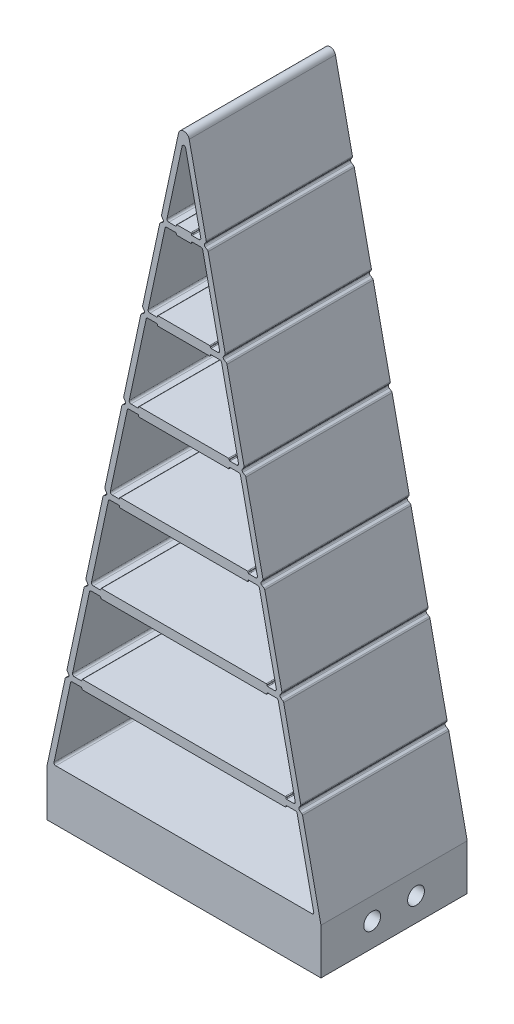
from build123d import *

# Parameters (mm, degrees)
BOSS_EXTRUDE1_DEPTH = 40
CUT_EXTRUDE3_DEPTH  = 184.388249351
FILLET2_R           = 1.5
FILLET3_R           = 0.5
FILLET4_R           = 0.2
FILLET5_R           = 0.5
SKETCH3_W           = 75
SKETCH3_H           = 12.5
BOSS_EXTRUDE2_DEPTH = 40
SKETCH5_W           = 6.5
SKETCH5_H           = 21.5
CUT_EXTRUDE2_DEPTH  = 12
SKETCH4_R           = 2.3
CUT_EXTRUDE1_DEPTH  = 190.47665973


with BuildPart() as part:
    # Sketch1 → Boss-Extrude1 (new body)
    with BuildSketch(Plane.XY):
        Polygon((37.5, 0), (-37.5, 0), (0, 175), align=None)
        Polygon((-30.583057249, 25.120155638), (-27.904485821, 25.120155638), (-27.904485821, 25.620155638), (27.904485821, 25.620155638), (27.904485821, 25.120155638), (30.583057249, 25.120155638), (25.735881041, 47.740311277), (22.735881041, 47.740311277), (22.735881041, 47.240311277), (-22.735881041, 47.240311277), (-22.735881041, 47.740311277), (-25.735881041, 47.740311277), align=None, mode=Mode.SUBTRACT)
        Polygon((35.644519172, 1.5), (-35.644519172, 1.5), (-30.904485821, 23.620155638), (-27.904485821, 23.620155638), (-27.904485821, 23.120155638), (27.904485821, 23.120155638), (27.904485821, 23.620155638), (30.904485821, 23.620155638), align=None, mode=Mode.SUBTRACT)
        Polygon((-25.41445247, 49.240311277), (-22.735881041, 49.240311277), (-22.735881041, 49.740311277), (22.735881041, 49.740311277), (22.735881041, 49.240311277), (25.41445247, 49.240311277), (20.567276261, 71.860466915), (17.567276261, 71.860466915), (17.567276261, 71.360466915), (-17.567276261, 71.360466915), (-17.567276261, 71.860466915), (-20.567276261, 71.860466915), align=None, mode=Mode.SUBTRACT)
        Polygon((-20.24584769, 73.360466915), (-17.567276261, 73.360466915), (-17.567276261, 73.860466915), (17.567276261, 73.860466915), (17.567276261, 73.360466915), (20.24584769, 73.360466915), (15.398671482, 95.980622553), (12.398671482, 95.980622553), (12.398671482, 95.480622553), (-12.398671482, 95.480622553), (-12.398671482, 95.980622553), (-15.398671482, 95.980622553), align=None, mode=Mode.SUBTRACT)
        Polygon((-15.07724291, 97.480622553), (-12.398671482, 97.480622553), (-12.398671482, 97.980622553), (12.398671482, 97.980622553), (12.398671482, 97.480622553), (15.07724291, 97.480622553), (10.230066702, 120.100778192), (7.230066702, 120.100778192), (7.230066702, 119.600778192), (-7.230066702, 119.600778192), (-7.230066702, 120.100778192), (-10.230066702, 120.100778192), align=None, mode=Mode.SUBTRACT)
        Polygon((-9.908638131, 121.600778192), (-7.230066702, 121.600778192), (-7.230066702, 122.100778192), (7.230066702, 122.100778192), (7.230066702, 121.600778192), (9.908638131, 121.600778192), (5.061461923, 144.22093383), (2.061461923, 144.22093383), (2.061461923, 143.72093383), (-2.061461923, 143.72093383), (-2.061461923, 144.22093383), (-5.061461923, 144.22093383), align=None, mode=Mode.SUBTRACT)
        Polygon((-4.740033351, 145.72093383), (-2.061461923, 145.72093383), (-2.061461923, 146.22093383), (2.061461923, 146.22093383), (2.061461923, 145.72093383), (4.740033351, 145.72093383), (0, 167.841089468), align=None, mode=Mode.SUBTRACT)
    extrude(amount=BOSS_EXTRUDE1_DEPTH)

    # Sketch6 → Cut-Extrude3 (cut, through all)
    with BuildSketch(Plane.XY.offset(40)):
        Polygon((-32.000946067, 25.662251686), (-31.232672742, 24.474920183), (-32.420004245, 23.706646857), align=None)
        Polygon((-26.832341288, 49.782407324), (-26.064067962, 48.595075821), (-27.251399465, 47.826802496), align=None)
        Polygon((-21.663736508, 73.902562962), (-20.895463183, 72.715231459), (-22.082794686, 71.946958134), align=None)
        Polygon((-16.495131728, 98.022718601), (-15.726858403, 96.835387098), (-16.914189906, 96.067113772), align=None)
        Polygon((-11.326526949, 122.142874239), (-10.558253623, 120.955542736), (-11.745585126, 120.187269411), align=None)
        Polygon((-6.157922169, 146.263029877), (-5.389648844, 145.075698374), (-6.576980347, 144.307425049), align=None)
        Polygon((6.576980347, 144.307425049), (6.157922169, 146.263029877), (5.389648844, 145.075698374), align=None)
        Polygon((11.745585126, 120.187269411), (11.326526949, 122.142874239), (10.558253623, 120.955542736), align=None)
        Polygon((16.914189906, 96.067113772), (16.495131728, 98.022718601), (15.726858403, 96.835387098), align=None)
        Polygon((22.082794686, 71.946958134), (21.663736508, 73.902562962), (20.895463183, 72.715231459), align=None)
        Polygon((27.251399465, 47.826802496), (26.832341288, 49.782407324), (26.064067962, 48.595075821), align=None)
        Polygon((32.420004245, 23.706646857), (32.000946067, 25.662251686), (31.232672742, 24.474920183), align=None)
    extrude(amount=-CUT_EXTRUDE3_DEPTH, mode=Mode.SUBTRACT)

    # Fillet2
    fillet2_edges = [part.edges().sort_by_distance(p)[0] for p in [
        (0, 175, 20),
    ]]
    fillet(fillet2_edges, radius=FILLET2_R)

    # Fillet3
    fillet3_edges = [part.edges().sort_by_distance(p)[0] for p in [
        (25.41445247, 49.240311277, 20),
        (20.567276261, 71.860466915, 20),
        (-20.567276261, 71.860466915, 20),
        (-25.41445247, 49.240311277, 20),
        (15.07724291, 97.480622553, 20),
        (10.230066702, 120.100778192, 20),
        (-10.230066702, 120.100778192, 20),
        (-15.07724291, 97.480622553, 20),
        (30.904485821, 23.620155638, 20),
        (9.908638131, 121.600778192, 20),
        (5.061461923, 144.22093383, 20),
        (-30.904485821, 23.620155638, 20),
        (-5.061461923, 144.22093383, 20),
        (-9.908638131, 121.600778192, 20),
        (-35.644519172, 1.5, 20),
        (35.644519172, 1.5, 20),
        (4.740033351, 145.72093383, 20),
        (0, 167.841089468, 20),
        (-4.740033351, 145.72093383, 20),
        (30.583057249, 25.120155638, 20),
        (25.735881041, 47.740311277, 20),
        (-25.735881041, 47.740311277, 20),
        (-30.583057249, 25.120155638, 20),
        (-15.398671482, 95.980622553, 20),
        (-20.24584769, 73.360466915, 20),
        (20.24584769, 73.360466915, 20),
        (15.398671482, 95.980622553, 20),
    ]]
    fillet(fillet3_edges, radius=FILLET3_R)

    # Fillet4
    fillet4_edges = [part.edges().sort_by_distance(p)[0] for p in [
        (-22.735881041, 49.240311277, 20),
        (-22.735881041, 49.740311277, 20),
        (22.735881041, 49.740311277, 20),
        (22.735881041, 49.240311277, 20),
        (17.567276261, 71.860466915, 20),
        (17.567276261, 71.360466915, 20),
        (-17.567276261, 71.360466915, 20),
        (-17.567276261, 71.860466915, 20),
        (-12.398671482, 97.480622553, 20),
        (-12.398671482, 97.980622553, 20),
        (12.398671482, 97.980622553, 20),
        (12.398671482, 97.480622553, 20),
        (7.230066702, 120.100778192, 20),
        (7.230066702, 119.600778192, 20),
        (-7.230066702, 119.600778192, 20),
        (-7.230066702, 120.100778192, 20),
        (27.904485821, 23.620155638, 20),
        (27.904485821, 23.120155638, 20),
        (-27.904485821, 23.120155638, 20),
        (-27.904485821, 23.620155638, 20),
        (-7.230066702, 121.600778192, 20),
        (-7.230066702, 122.100778192, 20),
        (7.230066702, 122.100778192, 20),
        (7.230066702, 121.600778192, 20),
        (2.061461923, 144.22093383, 20),
        (2.061461923, 143.72093383, 20),
        (-2.061461923, 143.72093383, 20),
        (-2.061461923, 144.22093383, 20),
        (-2.061461923, 145.72093383, 20),
        (-2.061461923, 146.22093383, 20),
        (2.061461923, 146.22093383, 20),
        (2.061461923, 145.72093383, 20),
        (-27.904485821, 25.120155638, 20),
        (-27.904485821, 25.620155638, 20),
        (27.904485821, 25.620155638, 20),
        (27.904485821, 25.120155638, 20),
        (22.735881041, 47.740311277, 20),
        (22.735881041, 47.240311277, 20),
        (-22.735881041, 47.240311277, 20),
        (-22.735881041, 47.740311277, 20),
        (-17.567276261, 73.360466915, 20),
        (-17.567276261, 73.860466915, 20),
        (17.567276261, 73.860466915, 20),
        (17.567276261, 73.360466915, 20),
        (12.398671482, 95.980622553, 20),
        (12.398671482, 95.480622553, 20),
        (-12.398671482, 95.480622553, 20),
        (-12.398671482, 95.980622553, 20),
    ]]
    fillet(fillet4_edges, radius=FILLET4_R)

    # Fillet5
    fillet5_edges = [part.edges().sort_by_distance(p)[0] for p in [
        (-32.420004245, 23.706646857, 20),
        (-32.000946067, 25.662251686, 20),
        (-31.232672742, 24.474920183, 20),
        (15.726858403, 96.835387098, 20),
        (16.495131728, 98.022718601, 20),
        (16.914189906, 96.067113772, 20),
        (10.558253623, 120.955542736, 20),
        (11.326526949, 122.142874239, 20),
        (11.745585126, 120.187269411, 20),
        (-6.576980347, 144.307425049, 20),
        (-6.157922169, 146.263029877, 20),
        (-5.389648844, 145.075698374, 20),
        (-11.745585126, 120.187269411, 20),
        (-11.326526949, 122.142874239, 20),
        (-10.558253623, 120.955542736, 20),
        (-27.251399465, 47.826802496, 20),
        (-26.832341288, 49.782407324, 20),
        (-26.064067962, 48.595075821, 20),
        (5.389648844, 145.075698374, 20),
        (6.157922169, 146.263029877, 20),
        (6.576980347, 144.307425049, 20),
        (-22.082794686, 71.946958134, 20),
        (-21.663736508, 73.902562962, 20),
        (-20.895463183, 72.715231459, 20),
        (-16.914189906, 96.067113772, 20),
        (-16.495131728, 98.022718601, 20),
        (-15.726858403, 96.835387098, 20),
        (20.895463183, 72.715231459, 20),
        (21.663736508, 73.902562962, 20),
        (22.082794686, 71.946958134, 20),
        (26.064067962, 48.595075821, 20),
        (26.832341288, 49.782407324, 20),
        (27.251399465, 47.826802496, 20),
        (31.232672742, 24.474920183, 20),
        (32.000946067, 25.662251686, 20),
        (32.420004245, 23.706646857, 20),
    ]]
    fillet(fillet5_edges, radius=FILLET5_R)

    # Sketch3 → Boss-Extrude2 (add)
    with BuildSketch(Plane.XY):
        with Locations((0, -6.25)):
            Rectangle(SKETCH3_W, SKETCH3_H)
    extrude(amount=BOSS_EXTRUDE2_DEPTH)

    # Sketch5 → Cut-Extrude2 (cut)
    with BuildSketch(Plane.XZ.offset(12.5)):
        with Locations((24.25, 20)):
            Rectangle(SKETCH5_W, SKETCH5_H)
    extrude(amount=-CUT_EXTRUDE2_DEPTH, mode=Mode.SUBTRACT)

    # Sketch4 → Cut-Extrude1 (cut, through all)
    with BuildSketch(Plane(origin=(37.5, 0, 0), x_dir=(0, 0, -1), z_dir=(1, 0, 0))):
        with Locations(Location((-26, -6, 0), (0, 0, 90))):
            Circle(SKETCH4_R)
        with Locations(Location((-14, -6, 0), (0, 0, 90))):
            Circle(SKETCH4_R)
    extrude(amount=-CUT_EXTRUDE1_DEPTH, mode=Mode.SUBTRACT)


solid = part.part
